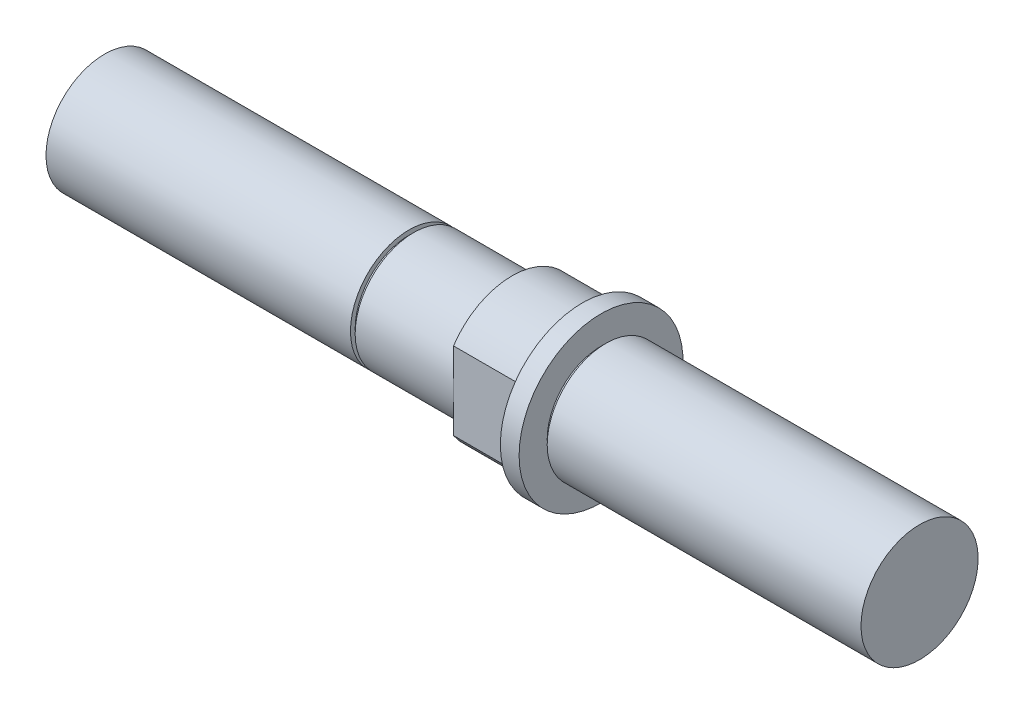
from build123d import *

# Parameters (mm, degrees)
SKETCH3_W          = 1
SKETCH3_H          = 1
CUT_EXTRUDE2_DEPTH = 15


with BuildPart() as part:
    # Sketch2 → Revolve1 (revolve)
    with BuildSketch(Plane.XY, mode=Mode.PRIVATE) as revolve1_sk:
        Polygon((0, 0), (0, 12.5), (-68, 12.5), (-68, 17.5), (-72, 17.5), (-72, 15), (-87, 15), (-87, 12.5), (-174, 12.5), (-174, 0), align=None)
    revolve(revolve1_sk.sketch.rotate(Axis((-174, 0, 0), (1, 0, 0)), 90), axis=Axis((-174, 0, 0), (1, 0, 0)))

    # Sketch3 → Cut-Revolve1 (revolve, cut)
    with BuildSketch(Plane.XY, mode=Mode.PRIVATE) as cut_revolve1_sk:
        with Locations((-67.5, 12)):
            Rectangle(SKETCH3_W, SKETCH3_H)
        with Locations((-108.5, 12)):
            Rectangle(SKETCH3_W, SKETCH3_H)
    revolve(cut_revolve1_sk.sketch.rotate(Axis((-174, 0, 0), (1, 0, 0)), 90), axis=Axis((-174, 0, 0), (1, 0, 0)), mode=Mode.SUBTRACT)

    # Sketch4 → Cut-Extrude2 (cut)
    with BuildSketch(Plane.ZY.offset(87)):
        with BuildLine():
            ThreePointArc((15, 0), (14.361406616, 4.330127019), (12.5, 8.291561976))
            Line((12.5, 8.291561976), (12.5, -8.291561976))
            ThreePointArc((12.5, -8.291561976), (14.361406616, -4.330127019), (15, 0))
        make_face()
        with BuildLine():
            Line((-12.5, -8.291561976), (-12.5, 8.291561976))
            ThreePointArc((-12.5, 8.291561976), (-15, 0), (-12.5, -8.291561976))
        make_face()
    extrude(amount=-CUT_EXTRUDE2_DEPTH, mode=Mode.SUBTRACT)


solid = part.part
